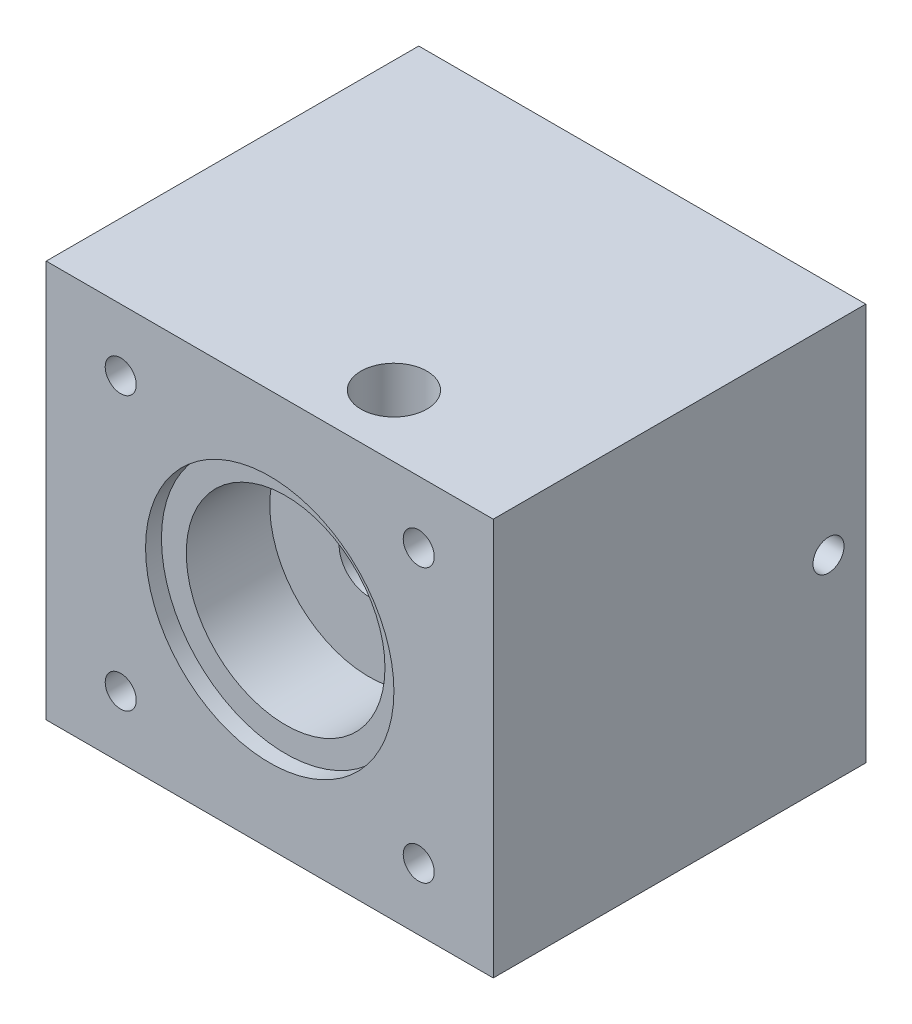
from build123d import *

# Parameters (mm, degrees)
SKETCH1_W           = 57.15
SKETCH1_H           = 50.8
BOSS_EXTRUDE1_DEPTH = 47.625
SKETCH2_R           = 3.8354
CUT_EXTRUDE1_DEPTH  = 91.08275709
SKETCH3_R           = 12.7
CUT_EXTRUDE2_DEPTH  = 12.7
SKETCH4_R           = 15.875
CUT_EXTRUDE3_DEPTH  = 2.032
SKETCH5_R           = 4.2164
CUT_EXTRUDE4_DEPTH  = 25.4
SKETCH6_R           = 6.35
CUT_EXTRUDE5_DEPTH  = 2.794
SKETCH7_R           = 1.98501
CUT_EXTRUDE6_DEPTH  = 6.35
SKETCH8_R           = 1.98501
CUT_EXTRUDE7_DEPTH  = 91.082757147
SKETCH9_R           = 1.98501
CUT_EXTRUDE9_DEPTH  = 11.1125
CUT_EXTRUDE10_START = -11.1125
SKETCH10_R          = 1.98501
CUT_EXTRUDE10_DEPTH = 11.1125


with BuildPart() as part:
    # Sketch1 → Boss-Extrude1 (new body)
    with BuildSketch(Plane.XY):
        with Locations((28.575, 25.4)):
            Rectangle(SKETCH1_W, SKETCH1_H)
    extrude(amount=BOSS_EXTRUDE1_DEPTH)

    # Sketch2 → Cut-Extrude1 (cut, through all)
    with BuildSketch(Plane.XY.offset(47.625)):
        with Locations((28.575, 25.4)):
            Circle(SKETCH2_R)
    extrude(amount=-CUT_EXTRUDE1_DEPTH, mode=Mode.SUBTRACT)

    # Sketch3 → Cut-Extrude2 (cut)
    with BuildSketch(Plane.XY.offset(47.625)):
        with Locations((28.575, 25.4)):
            Circle(SKETCH3_R)
    extrude(amount=-CUT_EXTRUDE2_DEPTH, mode=Mode.SUBTRACT)

    # Sketch4 → Cut-Extrude3 (cut)
    with BuildSketch(Plane.XY.offset(47.625)):
        with Locations((28.575, 25.4)):
            Circle(SKETCH4_R)
    extrude(amount=-CUT_EXTRUDE3_DEPTH, mode=Mode.SUBTRACT)

    # Sketch5 → Cut-Extrude4 (cut)
    with BuildSketch(Plane(origin=(0, 50.8, 0), x_dir=(1, 0, 0), z_dir=(0, 1, 0))):
        with Locations(Location((36.5125, -39.6875, 0), (0, 0, 270))):
            Circle(SKETCH5_R)
    extrude(amount=-CUT_EXTRUDE4_DEPTH, mode=Mode.SUBTRACT)

    # Sketch6 → Cut-Extrude5 (cut)
    with BuildSketch(Plane(origin=(0, 0, 0), x_dir=(-1, 0, 0), z_dir=(0, 0, -1))):
        with Locations((-28.575, 25.4)):
            Circle(SKETCH6_R)
    extrude(amount=-CUT_EXTRUDE5_DEPTH, mode=Mode.SUBTRACT)

    # Sketch7 → Cut-Extrude6 (cut)
    with BuildSketch(Plane(origin=(0, 0, 0), x_dir=(-1, 0, 0), z_dir=(0, 0, -1))):
        with Locations((-9.525, 25.4)):
            Circle(SKETCH7_R)
        with Locations((-47.625, 25.4)):
            Circle(SKETCH7_R)
    extrude(amount=-CUT_EXTRUDE6_DEPTH, mode=Mode.SUBTRACT)

    # Sketch8 → Cut-Extrude7 (cut, through all)
    with BuildSketch(Plane(origin=(0, 0, 0), x_dir=(-1, 0, 0), z_dir=(0, 0, -1))):
        with Locations((-47.625, 42.8625)):
            Circle(SKETCH8_R)
        with Locations((-9.525, 42.8625)):
            Circle(SKETCH8_R)
        with Locations((-9.525, 7.9375)):
            Circle(SKETCH8_R)
        with Locations((-47.625, 7.9375)):
            Circle(SKETCH8_R)
    extrude(amount=-CUT_EXTRUDE7_DEPTH, mode=Mode.SUBTRACT)

    # Sketch9 → Cut-Extrude9 (cut)
    with BuildSketch(Plane.ZY):
        with Locations((4.7625, 25.4)):
            Circle(SKETCH9_R)
    extrude(amount=-CUT_EXTRUDE9_DEPTH, mode=Mode.SUBTRACT)

    # Sketch10 → Cut-Extrude10 (cut)
    with BuildSketch(Plane(origin=(57.15, 0, 0), x_dir=(0, 0, -1), z_dir=(1, 0, 0)).offset(CUT_EXTRUDE10_START)):
        with Locations(Location((-4.7625, 25.4, 0), (0, 0, 180))):
            Circle(SKETCH10_R)
    extrude(amount=CUT_EXTRUDE10_DEPTH, mode=Mode.SUBTRACT)


solid = part.part
